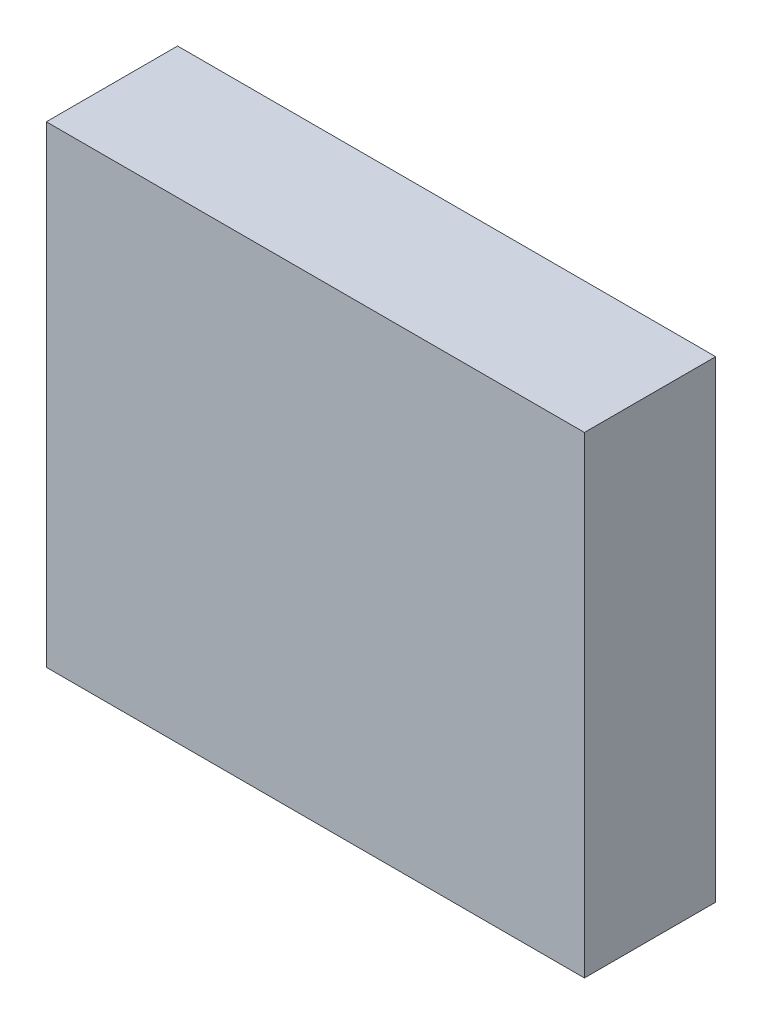
from build123d import *

# Parameters (mm, degrees)
SKETCH1_W               = 4.1
SKETCH1_H               = 3.6
COMPONENT_OUTLINE_DEPTH = 1


with BuildPart() as part:
    # Sketch1 → Component_Outline (new body)
    with BuildSketch(Plane.XY):
        with Locations((-0.2, 0.2)):
            Rectangle(SKETCH1_W, SKETCH1_H)
    extrude(amount=COMPONENT_OUTLINE_DEPTH)


solid = part.part
